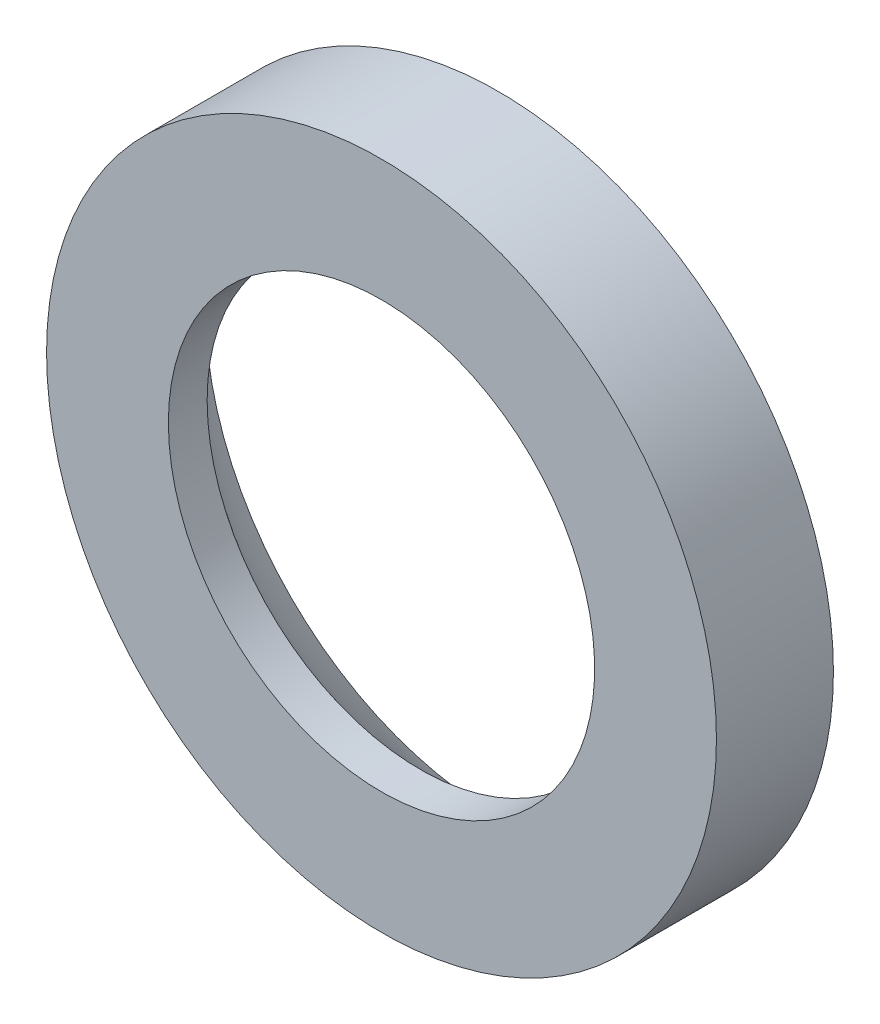
from build123d import *


with BuildPart() as part:
    # S01 - Printable flat rim and spherical seat → 01 - Printable flat rim and spherical seat (revolve)
    with BuildSketch(Plane(origin=(0, 0, 0), x_dir=(0, 0, -1), z_dir=(1, 0, 0)), mode=Mode.PRIVATE) as f_01_printable_flat_rim_and_spherical_se_sk:
        with BuildLine():
            Line((-4.2, 2.66), (-4.2, 4.18))
            Line((-4.2, 4.18), (-2.74, 4.18))
            Line((-2.74, 4.18), (-2.74, 3.657499146))
            ThreePointArc((-2.74, 3.657499146), (-3.266345794, 3.196229834), (-3.716086651, 2.66))
            Line((-3.716086651, 2.66), (-4.2, 2.66))
        make_face()
    revolve(f_01_printable_flat_rim_and_spherical_se_sk.sketch.rotate(Axis((0, 0, -15), (0, 0, 1)), 90), axis=Axis((0, 0, -15), (0, 0, 1)))


solid = part.part
